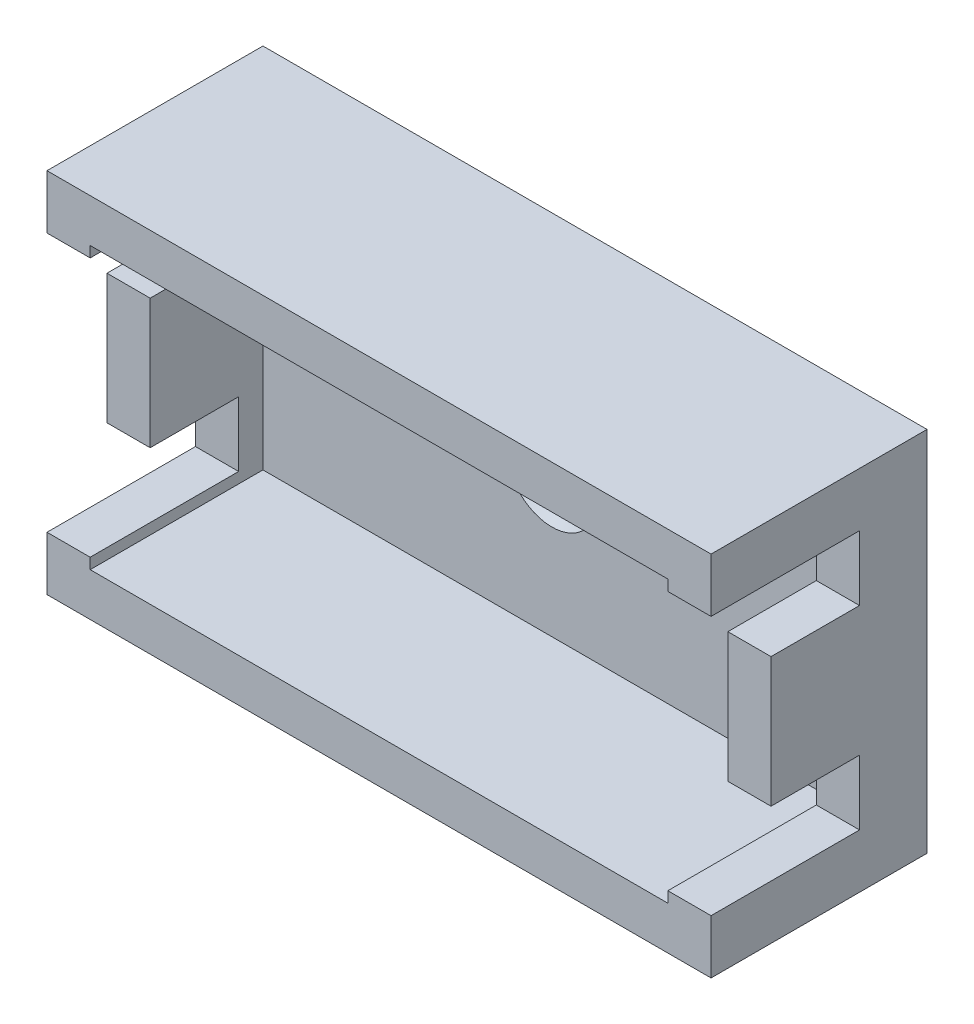
from build123d import *

# Parameters (mm, degrees)
SCHIZZO1_W                   = 61.5
SCHIZZO1_H                   = 34
SCHIZZO1_W_2                 = 53.5
SCHIZZO1_H_2                 = 26
ESTRUSIONE_SOTTILE1_DEPTH    = 20
SCHIZZO2_W                   = 53.5
SCHIZZO2_H                   = 26
ESTRUSIONE_ESTRUSIONE1_DEPTH = 4
SCHIZZO3_R                   = 2
TAGLIO_ESTRUSIONE1_DEPTH     = 4
TAGLIO_ESTRUSIONE3_DEPTH     = 72.289901108
SMUSSO1_SIZE                 = 2.2


with BuildPart() as part:
    # Schizzo1 → Estrusione-Sottile1 (new body)
    with BuildSketch(Plane.XY):
        with Locations((-26.75, 13)):
            Rectangle(SCHIZZO1_W, SCHIZZO1_H)
        with Locations((-26.75, 13)):
            Rectangle(SCHIZZO1_W_2, SCHIZZO1_H_2, mode=Mode.SUBTRACT)
    extrude(amount=ESTRUSIONE_SOTTILE1_DEPTH)

    # Schizzo2 → Estrusione-Estrusione1 (add)
    with BuildSketch(Plane.XY):
        with Locations((-26.75, 13)):
            Rectangle(SCHIZZO2_W, SCHIZZO2_H)
    extrude(amount=ESTRUSIONE_ESTRUSIONE1_DEPTH)

    # Schizzo3 → Taglio-Estrusione1 (cut)
    with BuildSketch(Plane.XY.offset(4)):
        with Locations((-26.75, 13)):
            Circle(SCHIZZO3_R)
    extrude(amount=-TAGLIO_ESTRUSIONE1_DEPTH, mode=Mode.SUBTRACT)

    # Schizzo4 → Taglio-Estrusione3 (cut, through all)
    with BuildSketch(Plane.ZY.offset(57.5)):
        Polygon((20, 110.783466983), (20, 27), (20, 25), (6.250230313, 25), (6.250230313, 19), (14.445683016, 19), (14.445683016, 7), (6.250230313, 7), (6.250230313, 1), (20, 1), (20, -1), (20, -84.783466983), (187.566933966, -84.783466983), (187.566933966, 110.783466983), align=None)
    extrude(amount=-TAGLIO_ESTRUSIONE3_DEPTH, mode=Mode.SUBTRACT)

    # Smusso1
    smusso1_edges = [part.edges().sort_by_distance(p)[0] for p in [
        (-28.75, 13, 4),
    ]]
    chamfer(smusso1_edges, length=SMUSSO1_SIZE)


solid = part.part
